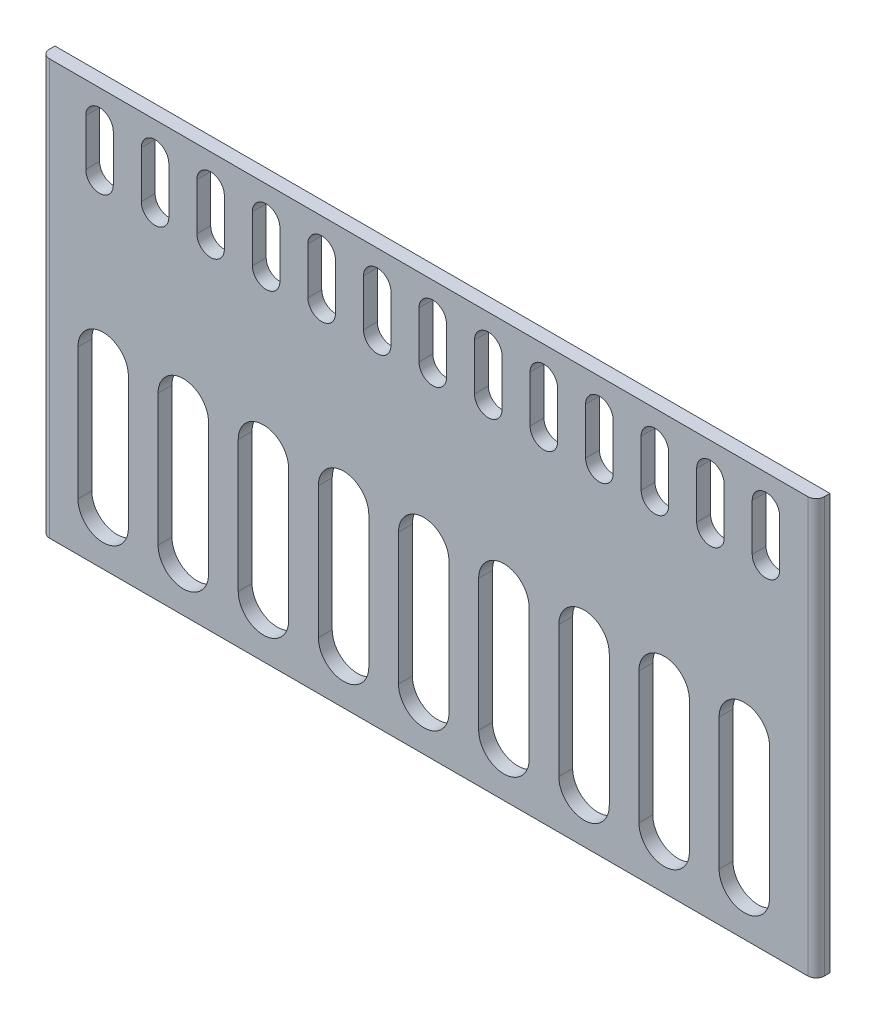
from build123d import *

# Parameters (mm, degrees)
SKETCH1_W           = 280
SKETCH1_H           = 150
BOSS_EXTRUDE1_DEPTH = 5
FILLET1_R           = 3
CUT_EXTRUDE1_REACH  = 294.66
CUT_EXTRUDE2_REACH  = 294.66


with BuildPart() as part:
    # Sketch1 → Boss-Extrude1 (new body)
    with BuildSketch(Plane.XY):
        with Locations((-140, 10)):
            Rectangle(SKETCH1_W, SKETCH1_H)
    extrude(amount=BOSS_EXTRUDE1_DEPTH)

    # Fillet1
    fillet1_edges = [part.edges().sort_by_distance(p)[0] for p in [
        (-280, 10, 5),
        (0, 10, 5),
    ]]
    fillet(fillet1_edges, radius=FILLET1_R)

    # Sketch2 → Cut-Extrude1 (cut, up to next)
    with BuildSketch(Plane.XY.offset(5), mode=Mode.PRIVATE) as cut_extrude1_sk1:
        with BuildLine():
            Line((-253.946258801, 73.812566177), (-253.946258801, 56.919370832))
            ThreePointArc((-253.946258801, 56.919370832), (-258.914845667, 51.950783966), (-263.883432533, 56.919370832))
            Line((-263.883432533, 56.919370832), (-263.883432533, 73.812566177))
            ThreePointArc((-263.883432533, 73.812566177), (-258.914845667, 78.781153044), (-253.946258801, 73.812566177))
        make_face()
    cut_extrude1_tool1 = extrude(cut_extrude1_sk1.sketch, amount=-CUT_EXTRUDE1_REACH, mode=Mode.PRIVATE) & part.part
    # Sketch2 → Cut-Extrude1 (cut, up to next)
    with BuildSketch(Plane.XY.offset(5), mode=Mode.PRIVATE) as cut_extrude1_sk2:
        with BuildLine():
            Line((-233.880258801, 73.812566177), (-233.880258801, 56.919370832))
            ThreePointArc((-233.880258801, 56.919370832), (-238.848845667, 51.950783966), (-243.817432533, 56.919370832))
            Line((-243.817432533, 56.919370832), (-243.817432533, 73.812566177))
            ThreePointArc((-243.817432533, 73.812566177), (-238.848845667, 78.781153044), (-233.880258801, 73.812566177))
        make_face()
    cut_extrude1_tool2 = extrude(cut_extrude1_sk2.sketch, amount=-CUT_EXTRUDE1_REACH, mode=Mode.PRIVATE) & part.part
    # Sketch2 → Cut-Extrude1 (cut, up to next)
    with BuildSketch(Plane.XY.offset(5), mode=Mode.PRIVATE) as cut_extrude1_sk3:
        with BuildLine():
            Line((-213.814258801, 73.812566177), (-213.814258801, 56.919370832))
            ThreePointArc((-213.814258801, 56.919370832), (-218.782845667, 51.950783966), (-223.751432533, 56.919370832))
            Line((-223.751432533, 56.919370832), (-223.751432533, 73.812566177))
            ThreePointArc((-223.751432533, 73.812566177), (-218.782845667, 78.781153044), (-213.814258801, 73.812566177))
        make_face()
    cut_extrude1_tool3 = extrude(cut_extrude1_sk3.sketch, amount=-CUT_EXTRUDE1_REACH, mode=Mode.PRIVATE) & part.part
    # Sketch2 → Cut-Extrude1 (cut, up to next)
    with BuildSketch(Plane.XY.offset(5), mode=Mode.PRIVATE) as cut_extrude1_sk4:
        with BuildLine():
            Line((-193.748258801, 73.812566177), (-193.748258801, 56.919370832))
            ThreePointArc((-193.748258801, 56.919370832), (-198.716845667, 51.950783966), (-203.685432533, 56.919370832))
            Line((-203.685432533, 56.919370832), (-203.685432533, 73.812566177))
            ThreePointArc((-203.685432533, 73.812566177), (-198.716845667, 78.781153044), (-193.748258801, 73.812566177))
        make_face()
    cut_extrude1_tool4 = extrude(cut_extrude1_sk4.sketch, amount=-CUT_EXTRUDE1_REACH, mode=Mode.PRIVATE) & part.part
    # Sketch2 → Cut-Extrude1 (cut, up to next)
    with BuildSketch(Plane.XY.offset(5), mode=Mode.PRIVATE) as cut_extrude1_sk5:
        with BuildLine():
            Line((-173.682258801, 73.812566177), (-173.682258801, 56.919370832))
            ThreePointArc((-173.682258801, 56.919370832), (-178.650845667, 51.950783966), (-183.619432533, 56.919370832))
            Line((-183.619432533, 56.919370832), (-183.619432533, 73.812566177))
            ThreePointArc((-183.619432533, 73.812566177), (-178.650845667, 78.781153044), (-173.682258801, 73.812566177))
        make_face()
    cut_extrude1_tool5 = extrude(cut_extrude1_sk5.sketch, amount=-CUT_EXTRUDE1_REACH, mode=Mode.PRIVATE) & part.part
    # Sketch2 → Cut-Extrude1 (cut, up to next)
    with BuildSketch(Plane.XY.offset(5), mode=Mode.PRIVATE) as cut_extrude1_sk6:
        with BuildLine():
            Line((-153.616258801, 73.812566177), (-153.616258801, 56.919370832))
            ThreePointArc((-153.616258801, 56.919370832), (-158.584845667, 51.950783966), (-163.553432533, 56.919370832))
            Line((-163.553432533, 56.919370832), (-163.553432533, 73.812566177))
            ThreePointArc((-163.553432533, 73.812566177), (-158.584845667, 78.781153044), (-153.616258801, 73.812566177))
        make_face()
    cut_extrude1_tool6 = extrude(cut_extrude1_sk6.sketch, amount=-CUT_EXTRUDE1_REACH, mode=Mode.PRIVATE) & part.part
    # Sketch2 → Cut-Extrude1 (cut, up to next)
    with BuildSketch(Plane.XY.offset(5), mode=Mode.PRIVATE) as cut_extrude1_sk7:
        with BuildLine():
            Line((-133.550258801, 73.812566177), (-133.550258801, 56.919370832))
            ThreePointArc((-133.550258801, 56.919370832), (-138.518845667, 51.950783966), (-143.487432533, 56.919370832))
            Line((-143.487432533, 56.919370832), (-143.487432533, 73.812566177))
            ThreePointArc((-143.487432533, 73.812566177), (-138.518845667, 78.781153044), (-133.550258801, 73.812566177))
        make_face()
    cut_extrude1_tool7 = extrude(cut_extrude1_sk7.sketch, amount=-CUT_EXTRUDE1_REACH, mode=Mode.PRIVATE) & part.part
    # Sketch2 → Cut-Extrude1 (cut, up to next)
    with BuildSketch(Plane.XY.offset(5), mode=Mode.PRIVATE) as cut_extrude1_sk8:
        with BuildLine():
            Line((-113.484258801, 73.812566177), (-113.484258801, 56.919370832))
            ThreePointArc((-113.484258801, 56.919370832), (-118.452845667, 51.950783966), (-123.421432533, 56.919370832))
            Line((-123.421432533, 56.919370832), (-123.421432533, 73.812566177))
            ThreePointArc((-123.421432533, 73.812566177), (-118.452845667, 78.781153044), (-113.484258801, 73.812566177))
        make_face()
    cut_extrude1_tool8 = extrude(cut_extrude1_sk8.sketch, amount=-CUT_EXTRUDE1_REACH, mode=Mode.PRIVATE) & part.part
    # Sketch2 → Cut-Extrude1 (cut, up to next)
    with BuildSketch(Plane.XY.offset(5), mode=Mode.PRIVATE) as cut_extrude1_sk9:
        with BuildLine():
            Line((-93.418258801, 73.812566177), (-93.418258801, 56.919370832))
            ThreePointArc((-93.418258801, 56.919370832), (-98.386845667, 51.950783966), (-103.355432533, 56.919370832))
            Line((-103.355432533, 56.919370832), (-103.355432533, 73.812566177))
            ThreePointArc((-103.355432533, 73.812566177), (-98.386845667, 78.781153044), (-93.418258801, 73.812566177))
        make_face()
    cut_extrude1_tool9 = extrude(cut_extrude1_sk9.sketch, amount=-CUT_EXTRUDE1_REACH, mode=Mode.PRIVATE) & part.part
    # Sketch2 → Cut-Extrude1 (cut, up to next)
    with BuildSketch(Plane.XY.offset(5), mode=Mode.PRIVATE) as cut_extrude1_sk10:
        with BuildLine():
            Line((-73.352258801, 73.812566177), (-73.352258801, 56.919370832))
            ThreePointArc((-73.352258801, 56.919370832), (-78.320845667, 51.950783966), (-83.289432533, 56.919370832))
            Line((-83.289432533, 56.919370832), (-83.289432533, 73.812566177))
            ThreePointArc((-83.289432533, 73.812566177), (-78.320845667, 78.781153044), (-73.352258801, 73.812566177))
        make_face()
    cut_extrude1_tool10 = extrude(cut_extrude1_sk10.sketch, amount=-CUT_EXTRUDE1_REACH, mode=Mode.PRIVATE) & part.part
    # Sketch2 → Cut-Extrude1 (cut, up to next)
    with BuildSketch(Plane.XY.offset(5), mode=Mode.PRIVATE) as cut_extrude1_sk11:
        with BuildLine():
            Line((-53.286258801, 73.812566177), (-53.286258801, 56.919370832))
            ThreePointArc((-53.286258801, 56.919370832), (-58.254845667, 51.950783966), (-63.223432533, 56.919370832))
            Line((-63.223432533, 56.919370832), (-63.223432533, 73.812566177))
            ThreePointArc((-63.223432533, 73.812566177), (-58.254845667, 78.781153044), (-53.286258801, 73.812566177))
        make_face()
    cut_extrude1_tool11 = extrude(cut_extrude1_sk11.sketch, amount=-CUT_EXTRUDE1_REACH, mode=Mode.PRIVATE) & part.part
    # Sketch2 → Cut-Extrude1 (cut, up to next)
    with BuildSketch(Plane.XY.offset(5), mode=Mode.PRIVATE) as cut_extrude1_sk12:
        with BuildLine():
            Line((-33.220258801, 73.812566177), (-33.220258801, 56.919370832))
            ThreePointArc((-33.220258801, 56.919370832), (-38.188845667, 51.950783966), (-43.157432533, 56.919370832))
            Line((-43.157432533, 56.919370832), (-43.157432533, 73.812566177))
            ThreePointArc((-43.157432533, 73.812566177), (-38.188845667, 78.781153044), (-33.220258801, 73.812566177))
        make_face()
    cut_extrude1_tool12 = extrude(cut_extrude1_sk12.sketch, amount=-CUT_EXTRUDE1_REACH, mode=Mode.PRIVATE) & part.part
    # Sketch2 → Cut-Extrude1 (cut, up to next)
    with BuildSketch(Plane.XY.offset(5), mode=Mode.PRIVATE) as cut_extrude1_sk13:
        with BuildLine():
            Line((-13.154258801, 73.812566177), (-13.154258801, 56.919370832))
            ThreePointArc((-13.154258801, 56.919370832), (-18.122845667, 51.950783966), (-23.091432533, 56.919370832))
            Line((-23.091432533, 56.919370832), (-23.091432533, 73.812566177))
            ThreePointArc((-23.091432533, 73.812566177), (-18.122845667, 78.781153044), (-13.154258801, 73.812566177))
        make_face()
    cut_extrude1_tool13 = extrude(cut_extrude1_sk13.sketch, amount=-CUT_EXTRUDE1_REACH, mode=Mode.PRIVATE) & part.part
    add(cut_extrude1_tool1.solids().sort_by_distance((-258.914846, 65.365969, 5))[0], mode=Mode.SUBTRACT)
    add(cut_extrude1_tool2.solids().sort_by_distance((-238.848846, 65.365969, 5))[0], mode=Mode.SUBTRACT)
    add(cut_extrude1_tool3.solids().sort_by_distance((-218.782846, 65.365969, 5))[0], mode=Mode.SUBTRACT)
    add(cut_extrude1_tool4.solids().sort_by_distance((-198.716846, 65.365969, 5))[0], mode=Mode.SUBTRACT)
    add(cut_extrude1_tool5.solids().sort_by_distance((-178.650846, 65.365969, 5))[0], mode=Mode.SUBTRACT)
    add(cut_extrude1_tool6.solids().sort_by_distance((-158.584846, 65.365969, 5))[0], mode=Mode.SUBTRACT)
    add(cut_extrude1_tool7.solids().sort_by_distance((-138.518846, 65.365969, 5))[0], mode=Mode.SUBTRACT)
    add(cut_extrude1_tool8.solids().sort_by_distance((-118.452846, 65.365969, 5))[0], mode=Mode.SUBTRACT)
    add(cut_extrude1_tool9.solids().sort_by_distance((-98.386846, 65.365969, 5))[0], mode=Mode.SUBTRACT)
    add(cut_extrude1_tool10.solids().sort_by_distance((-78.320846, 65.365969, 5))[0], mode=Mode.SUBTRACT)
    add(cut_extrude1_tool11.solids().sort_by_distance((-58.254846, 65.365969, 5))[0], mode=Mode.SUBTRACT)
    add(cut_extrude1_tool12.solids().sort_by_distance((-38.188846, 65.365969, 5))[0], mode=Mode.SUBTRACT)
    add(cut_extrude1_tool13.solids().sort_by_distance((-18.122846, 65.365969, 5))[0], mode=Mode.SUBTRACT)

    # Sketch3 → Cut-Extrude2 (cut, up to next)
    with BuildSketch(Plane.XY.offset(5), mode=Mode.PRIVATE) as cut_extrude2_sk1:
        with BuildLine():
            Line((-248.480205324, 0), (-248.480205324, -47.553445355))
            ThreePointArc((-248.480205324, -47.553445355), (-257.592542571, -56.665782602), (-266.704879818, -47.553445355))
            Line((-266.704879818, -47.553445355), (-266.704879818, 0))
            ThreePointArc((-266.704879818, 0), (-257.592542571, 9.112337247), (-248.480205324, 0))
        make_face()
    cut_extrude2_tool1 = extrude(cut_extrude2_sk1.sketch, amount=-CUT_EXTRUDE2_REACH, mode=Mode.PRIVATE) & part.part
    # Sketch3 → Cut-Extrude2 (cut, up to next)
    with BuildSketch(Plane.XY.offset(5), mode=Mode.PRIVATE) as cut_extrude2_sk2:
        with BuildLine():
            Line((-219.524205324, 0), (-219.524205324, -47.553445355))
            ThreePointArc((-219.524205324, -47.553445355), (-228.636542571, -56.665782602), (-237.748879818, -47.553445355))
            Line((-237.748879818, -47.553445355), (-237.748879818, 0))
            ThreePointArc((-237.748879818, 0), (-228.636542571, 9.112337247), (-219.524205324, 0))
        make_face()
    cut_extrude2_tool2 = extrude(cut_extrude2_sk2.sketch, amount=-CUT_EXTRUDE2_REACH, mode=Mode.PRIVATE) & part.part
    # Sketch3 → Cut-Extrude2 (cut, up to next)
    with BuildSketch(Plane.XY.offset(5), mode=Mode.PRIVATE) as cut_extrude2_sk3:
        with BuildLine():
            Line((-190.568205324, 0), (-190.568205324, -47.553445355))
            ThreePointArc((-190.568205324, -47.553445355), (-199.680542571, -56.665782602), (-208.792879818, -47.553445355))
            Line((-208.792879818, -47.553445355), (-208.792879818, 0))
            ThreePointArc((-208.792879818, 0), (-199.680542571, 9.112337247), (-190.568205324, 0))
        make_face()
    cut_extrude2_tool3 = extrude(cut_extrude2_sk3.sketch, amount=-CUT_EXTRUDE2_REACH, mode=Mode.PRIVATE) & part.part
    # Sketch3 → Cut-Extrude2 (cut, up to next)
    with BuildSketch(Plane.XY.offset(5), mode=Mode.PRIVATE) as cut_extrude2_sk4:
        with BuildLine():
            Line((-161.612205324, 0), (-161.612205324, -47.553445355))
            ThreePointArc((-161.612205324, -47.553445355), (-170.724542571, -56.665782602), (-179.836879818, -47.553445355))
            Line((-179.836879818, -47.553445355), (-179.836879818, 0))
            ThreePointArc((-179.836879818, 0), (-170.724542571, 9.112337247), (-161.612205324, 0))
        make_face()
    cut_extrude2_tool4 = extrude(cut_extrude2_sk4.sketch, amount=-CUT_EXTRUDE2_REACH, mode=Mode.PRIVATE) & part.part
    # Sketch3 → Cut-Extrude2 (cut, up to next)
    with BuildSketch(Plane.XY.offset(5), mode=Mode.PRIVATE) as cut_extrude2_sk5:
        with BuildLine():
            Line((-132.656205324, 0), (-132.656205324, -47.553445355))
            ThreePointArc((-132.656205324, -47.553445355), (-141.768542571, -56.665782602), (-150.880879818, -47.553445355))
            Line((-150.880879818, -47.553445355), (-150.880879818, 0))
            ThreePointArc((-150.880879818, 0), (-141.768542571, 9.112337247), (-132.656205324, 0))
        make_face()
    cut_extrude2_tool5 = extrude(cut_extrude2_sk5.sketch, amount=-CUT_EXTRUDE2_REACH, mode=Mode.PRIVATE) & part.part
    # Sketch3 → Cut-Extrude2 (cut, up to next)
    with BuildSketch(Plane.XY.offset(5), mode=Mode.PRIVATE) as cut_extrude2_sk6:
        with BuildLine():
            Line((-103.700205324, 0), (-103.700205324, -47.553445355))
            ThreePointArc((-103.700205324, -47.553445355), (-112.812542571, -56.665782602), (-121.924879818, -47.553445355))
            Line((-121.924879818, -47.553445355), (-121.924879818, 0))
            ThreePointArc((-121.924879818, 0), (-112.812542571, 9.112337247), (-103.700205324, 0))
        make_face()
    cut_extrude2_tool6 = extrude(cut_extrude2_sk6.sketch, amount=-CUT_EXTRUDE2_REACH, mode=Mode.PRIVATE) & part.part
    # Sketch3 → Cut-Extrude2 (cut, up to next)
    with BuildSketch(Plane.XY.offset(5), mode=Mode.PRIVATE) as cut_extrude2_sk7:
        with BuildLine():
            Line((-74.744205324, 0), (-74.744205324, -47.553445355))
            ThreePointArc((-74.744205324, -47.553445355), (-83.856542571, -56.665782602), (-92.968879818, -47.553445355))
            Line((-92.968879818, -47.553445355), (-92.968879818, 0))
            ThreePointArc((-92.968879818, 0), (-83.856542571, 9.112337247), (-74.744205324, 0))
        make_face()
    cut_extrude2_tool7 = extrude(cut_extrude2_sk7.sketch, amount=-CUT_EXTRUDE2_REACH, mode=Mode.PRIVATE) & part.part
    # Sketch3 → Cut-Extrude2 (cut, up to next)
    with BuildSketch(Plane.XY.offset(5), mode=Mode.PRIVATE) as cut_extrude2_sk8:
        with BuildLine():
            Line((-45.788205324, 0), (-45.788205324, -47.553445355))
            ThreePointArc((-45.788205324, -47.553445355), (-54.900542571, -56.665782602), (-64.012879818, -47.553445355))
            Line((-64.012879818, -47.553445355), (-64.012879818, 0))
            ThreePointArc((-64.012879818, 0), (-54.900542571, 9.112337247), (-45.788205324, 0))
        make_face()
    cut_extrude2_tool8 = extrude(cut_extrude2_sk8.sketch, amount=-CUT_EXTRUDE2_REACH, mode=Mode.PRIVATE) & part.part
    # Sketch3 → Cut-Extrude2 (cut, up to next)
    with BuildSketch(Plane.XY.offset(5), mode=Mode.PRIVATE) as cut_extrude2_sk9:
        with BuildLine():
            Line((-16.832205324, 0), (-16.832205324, -47.553445355))
            ThreePointArc((-16.832205324, -47.553445355), (-25.944542571, -56.665782602), (-35.056879818, -47.553445355))
            Line((-35.056879818, -47.553445355), (-35.056879818, 0))
            ThreePointArc((-35.056879818, 0), (-25.944542571, 9.112337247), (-16.832205324, 0))
        make_face()
    cut_extrude2_tool9 = extrude(cut_extrude2_sk9.sketch, amount=-CUT_EXTRUDE2_REACH, mode=Mode.PRIVATE) & part.part
    add(cut_extrude2_tool1.solids().sort_by_distance((-257.592543, -23.776723, 5))[0], mode=Mode.SUBTRACT)
    add(cut_extrude2_tool2.solids().sort_by_distance((-228.636543, -23.776723, 5))[0], mode=Mode.SUBTRACT)
    add(cut_extrude2_tool3.solids().sort_by_distance((-199.680543, -23.776723, 5))[0], mode=Mode.SUBTRACT)
    add(cut_extrude2_tool4.solids().sort_by_distance((-170.724543, -23.776723, 5))[0], mode=Mode.SUBTRACT)
    add(cut_extrude2_tool5.solids().sort_by_distance((-141.768543, -23.776723, 5))[0], mode=Mode.SUBTRACT)
    add(cut_extrude2_tool6.solids().sort_by_distance((-112.812543, -23.776723, 5))[0], mode=Mode.SUBTRACT)
    add(cut_extrude2_tool7.solids().sort_by_distance((-83.856543, -23.776723, 5))[0], mode=Mode.SUBTRACT)
    add(cut_extrude2_tool8.solids().sort_by_distance((-54.900543, -23.776723, 5))[0], mode=Mode.SUBTRACT)
    add(cut_extrude2_tool9.solids().sort_by_distance((-25.944543, -23.776723, 5))[0], mode=Mode.SUBTRACT)


solid = part.part
